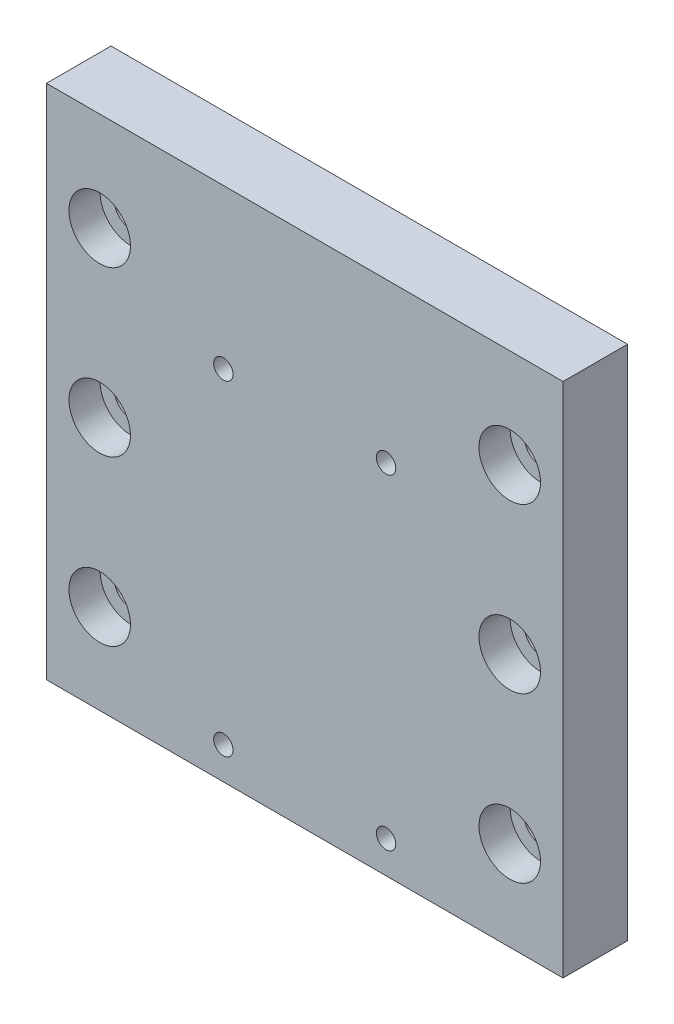
from build123d import *

# Parameters (mm, degrees)
SKETCH1_W                                       = 80
SKETCH1_H                                       = 80
EXTRUDE1_DEPTH                                  = 10
CBORE_FOR_10_SOCKET_HEAD_CAP_SCREW2_D           = 5.1054
CBORE_FOR_10_SOCKET_HEAD_CAP_SCREW2_CBORE_D     = 9.525
CBORE_FOR_10_SOCKET_HEAD_CAP_SCREW2_CBORE_DEPTH = 4.826
M3X0_5_TAPPED_HOLE1_AT_2_COUNT                  = 2
M3X0_5_TAPPED_HOLE1_AT_2_PITCH                  = 50.4
LPATTERN4_COUNT                                 = 2
LPATTERN4_PITCH                                 = 25.2


with BuildPart() as part:
    # Sketch1 → Extrude1 (new body)
    with BuildSketch(Plane.XY):
        with Locations((-15.736421911, 19.385081585)):
            Rectangle(SKETCH1_W, SKETCH1_H)
    extrude(amount=EXTRUDE1_DEPTH)

    # CBORE for #10 Socket Head Cap Screw2 (through all)
    with Locations(Plane(origin=(-47.486421911, 44.077855478, 10), x_dir=(1, 0, 0), z_dir=(0, 0, 1))):
        with Locations((0, 0), (0, -25.4), (0, -50.8), (63.5, -50.8), (63.5, -25.4), (63.5, 0)):
            CounterBoreHole(CBORE_FOR_10_SOCKET_HEAD_CAP_SCREW2_D / 2, CBORE_FOR_10_SOCKET_HEAD_CAP_SCREW2_CBORE_D / 2, CBORE_FOR_10_SOCKET_HEAD_CAP_SCREW2_CBORE_DEPTH)

    # Sketch4 → M3x0.5 Tapped Hole1 (revolve, cut)
    with BuildSketch(Plane(origin=(-28.336421911, 34.785081585, 10), x_dir=(0, -1, 0), z_dir=(1, 0, 0))):
        Polygon((0, 0), (0, 8.251075774), (1.25, 7.5), (1.25, 6), (1.5, 6), (1.5, 0), align=None)
    m3x0_5_tapped_hole1 = revolve(axis=Axis((-28.336421911, 34.785081585, 16.35), (0, 0, -1)), mode=Mode.SUBTRACT)

    # M3x0.5 Tapped Hole1 at 2: M3x0.5 Tapped Hole1 ×2
    with Locations(*[(0, -i * M3X0_5_TAPPED_HOLE1_AT_2_PITCH, 0) for i in range(1, M3X0_5_TAPPED_HOLE1_AT_2_COUNT)]):
        add(m3x0_5_tapped_hole1, mode=Mode.SUBTRACT)

    # LPattern4: M3x0.5 Tapped Hole1 ×2
    with Locations(*[(i * LPATTERN4_PITCH, 0, 0) for i in range(1, LPATTERN4_COUNT)]):
        add(m3x0_5_tapped_hole1, mode=Mode.SUBTRACT)

    # LPattern4 copy 1 sketch → LPattern4 copy 1 (revolve, cut)
    with BuildSketch(Plane(origin=(-3.136421911, -15.614918415, 10), x_dir=(0, -1, 0), z_dir=(1, 0, 0))):
        Polygon((0, 0), (0, 8.251075774), (1.25, 7.5), (1.25, 6), (1.5, 6), (1.5, 0), align=None)
    revolve(axis=Axis((-3.136421911, -15.614918415, 16.35), (0, 0, -1)), mode=Mode.SUBTRACT)


solid = part.part
